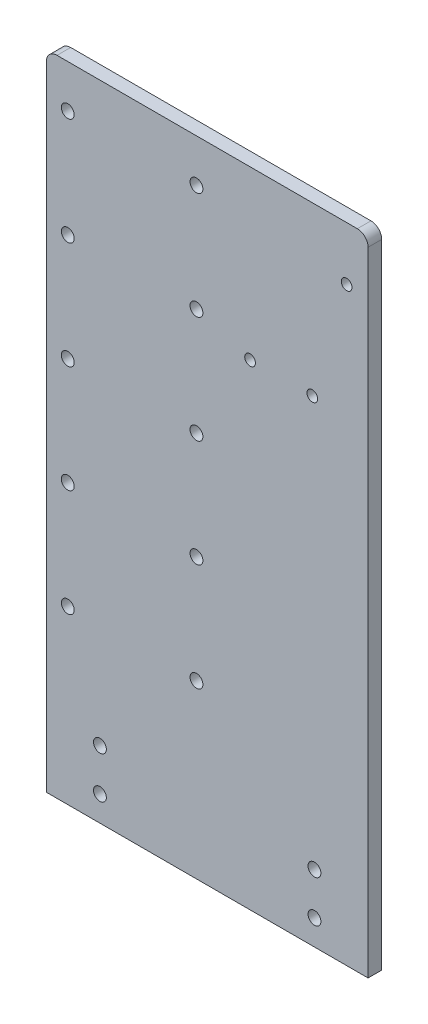
from build123d import *

# Parameters (mm, degrees)
SKETCH1_W           = 150
SKETCH1_H           = 300
BOSS_EXTRUDE1_DEPTH = 6.35
SKETCH2_R           = 3
CUT_EXTRUDE1_DEPTH  = 240.233244061
SKETCH3_R           = 2.5
SKETCH3_R_2         = 3
CUT_EXTRUDE2_DEPTH  = 240.233244061
FILLET1_R           = 5


with BuildPart() as part:
    # Sketch1 → Boss-Extrude1 (new body)
    with BuildSketch(Plane.XY):
        with Locations((22.488704023, -68.37622387)):
            Rectangle(SKETCH1_W, SKETCH1_H)
    extrude(amount=BOSS_EXTRUDE1_DEPTH)

    # Sketch2 → Cut-Extrude1 (cut, through all)
    with BuildSketch(Plane.XY.offset(6.35)):
        with Locations((-27.511295977, -206.57622387)):
            Circle(SKETCH2_R)
        with Locations((-27.511295977, -187.07622387)):
            Circle(SKETCH2_R)
        with Locations((72.488704023, -206.57622387)):
            Circle(SKETCH2_R)
        with Locations((72.488704023, -187.07622387)):
            Circle(SKETCH2_R)
    extrude(amount=-CUT_EXTRUDE1_DEPTH, mode=Mode.SUBTRACT)

    # Sketch3 → Cut-Extrude2 (cut, through all)
    with BuildSketch(Plane.XY.offset(6.35)):
        with Locations((42.488704023, 3.62377613)):
            Circle(SKETCH3_R)
        with Locations((71.488704023, 3.62377613)):
            Circle(SKETCH3_R)
        with Locations((87.488704023, 56.62377613)):
            Circle(SKETCH3_R)
        with Locations((-42.511295977, -38.37622387)):
            Circle(SKETCH3_R_2)
        with Locations((17.488704023, -38.37622387)):
            Circle(SKETCH3_R_2)
        with Locations((-42.511295977, -138.37622387)):
            Circle(SKETCH3_R_2)
        with Locations((17.488704023, -138.37622387)):
            Circle(SKETCH3_R_2)
        with Locations((-42.511295977, -88.37622387)):
            Circle(SKETCH3_R_2)
        with Locations((17.488704023, -88.37622387)):
            Circle(SKETCH3_R_2)
        with Locations((-42.511295977, 11.62377613)):
            Circle(SKETCH3_R_2)
        with Locations((17.488704023, 11.62377613)):
            Circle(SKETCH3_R_2)
        with Locations((-42.511295977, 61.62377613)):
            Circle(SKETCH3_R_2)
        with Locations((17.488704023, 61.62377613)):
            Circle(SKETCH3_R_2)
    extrude(amount=-CUT_EXTRUDE2_DEPTH, mode=Mode.SUBTRACT)

    # Fillet1
    fillet1_edges = [part.edges().sort_by_distance(p)[0] for p in [
        (-52.511295977, 81.62377613, 3.175),
        (97.488704023, 81.62377613, 3.175),
    ]]
    fillet(fillet1_edges, radius=FILLET1_R)


solid = part.part
